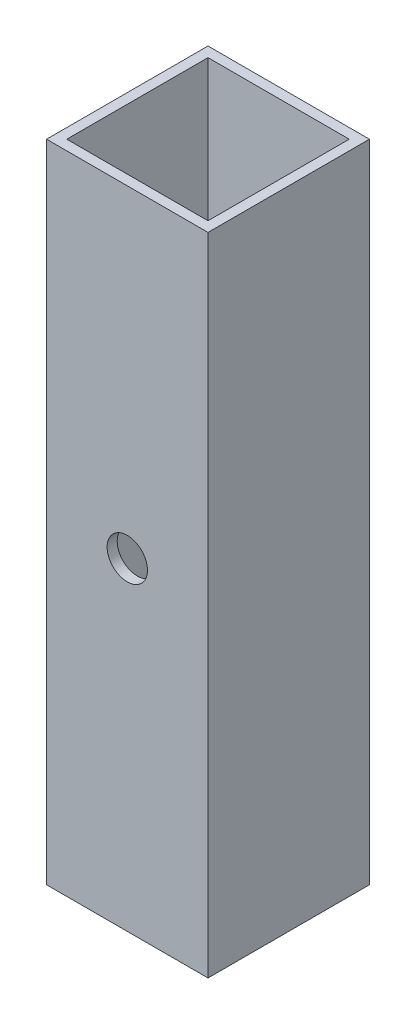
from build123d import *

# Parameters (mm, degrees)
SKETCH1_W           = 25.4
SKETCH1_H           = 25.4
SKETCH1_W_2         = 22.225
SKETCH1_H_2         = 22.225
BOSS_EXTRUDE1_DEPTH = 101.6
SKETCH2_R           = 3.175
CUT_EXTRUDE1_DEPTH  = 106.494123059


with BuildPart() as part:
    # Sketch1 → Boss-Extrude1 (new body)
    with BuildSketch(Plane(origin=(0, 0, 0), x_dir=(1, 0, 0), z_dir=(0, 1, 0))):
        Rectangle(SKETCH1_W, SKETCH1_H)
        Rectangle(SKETCH1_W_2, SKETCH1_H_2, mode=Mode.SUBTRACT)
    extrude(amount=BOSS_EXTRUDE1_DEPTH)

    # Sketch2 → Cut-Extrude1 (cut, through all)
    with BuildSketch(Plane.XY.offset(12.7)):
        with Locations((0, 50.8)):
            Circle(SKETCH2_R)
    extrude(amount=-CUT_EXTRUDE1_DEPTH, mode=Mode.SUBTRACT)


solid = part.part
